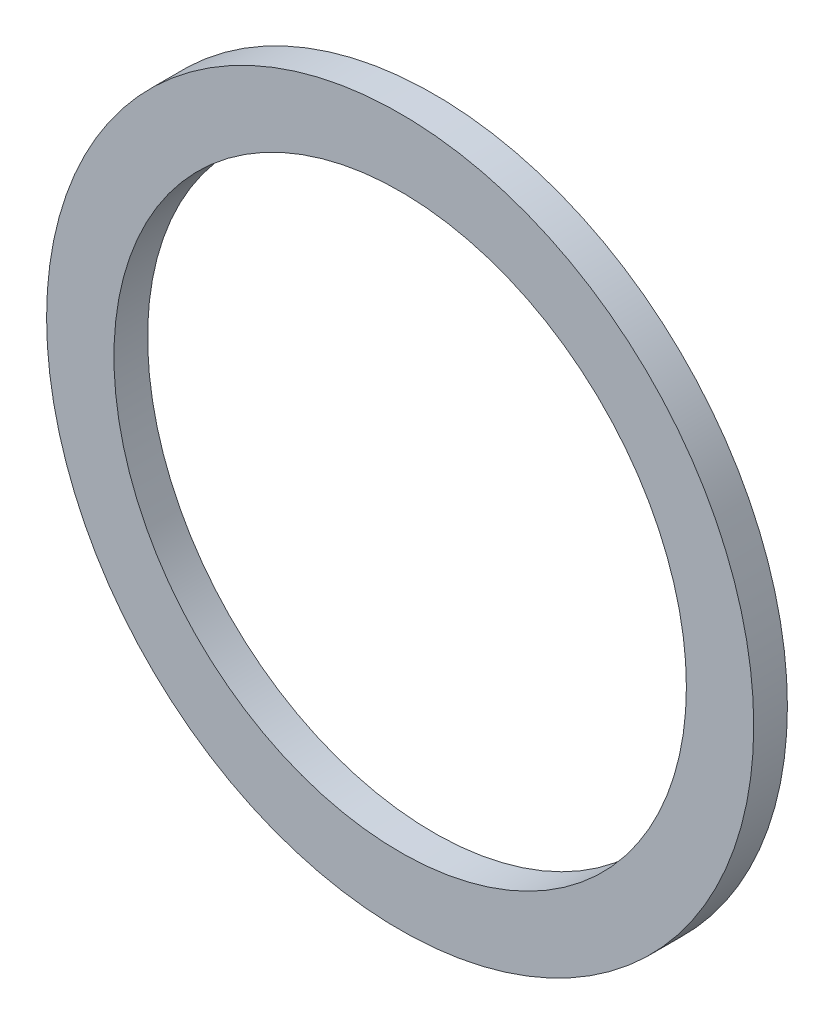
from build123d import *

# Parameters (mm, degrees)
SKETCH1_R           = 21
SKETCH1_R_2         = 17
BOSS_EXTRUDE1_DEPTH = 2


with BuildPart() as part:
    # Sketch1 → Boss-Extrude1 (new body)
    with BuildSketch(Plane.XY):
        Circle(SKETCH1_R)
        Circle(SKETCH1_R_2, mode=Mode.SUBTRACT)
    extrude(amount=BOSS_EXTRUDE1_DEPTH)


solid = part.part
